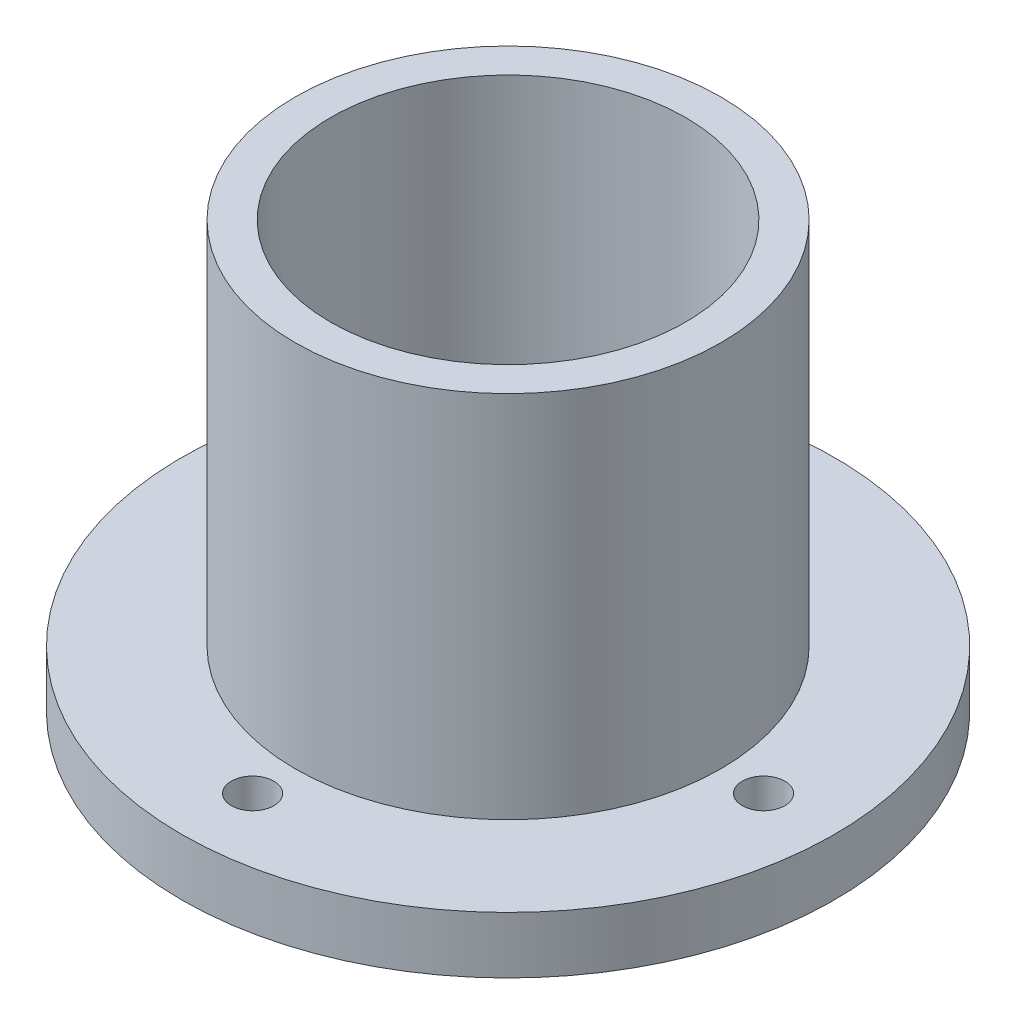
from build123d import *

# Parameters (mm, degrees)
SKETCH_1_R          = 15
SKETCH_1_R_2        = 12.5
EXTRUDE_1_DEPTH     = 30
SKETCH_1_3_R        = 23
SKETCH_1_3_R_2      = 15
EXTRUDE_2_DEPTH     = 4
CUT_EXTRUDE_3_REACH = 46.249
SKETCH_3_R          = 1.5


with BuildPart() as part:
    # 草图1 → 凸台-拉伸1 (new body)
    with BuildSketch(Plane(origin=(0, 0, 0), x_dir=(1, 0, 0), z_dir=(0, 1, 0))):
        Circle(SKETCH_1_R)
        Circle(SKETCH_1_R_2, mode=Mode.SUBTRACT)
    extrude(amount=EXTRUDE_1_DEPTH)

    # 草图1<3> → 凸台-拉伸2 (add)
    with BuildSketch(Plane(origin=(0, 0, 0), x_dir=(1, 0, 0), z_dir=(0, 1, 0))):
        Circle(SKETCH_1_3_R)
        Circle(SKETCH_1_3_R_2, mode=Mode.SUBTRACT)
    extrude(amount=EXTRUDE_2_DEPTH)

    # 草图3 → 切除-拉伸3 (cut, up to next)
    with BuildSketch(Plane.XZ, mode=Mode.PRIVATE) as cut_extrude_3_sk1:
        with Locations((0, 18)):
            Circle(SKETCH_3_R)
    cut_extrude_3_tool1 = extrude(cut_extrude_3_sk1.sketch, amount=-CUT_EXTRUDE_3_REACH, mode=Mode.PRIVATE) & part.part
    # 草图3 → 切除-拉伸3 (cut, up to next)
    with BuildSketch(Plane.XZ, mode=Mode.PRIVATE) as cut_extrude_3_sk2:
        with Locations((18, 0)):
            Circle(SKETCH_3_R)
    cut_extrude_3_tool2 = extrude(cut_extrude_3_sk2.sketch, amount=-CUT_EXTRUDE_3_REACH, mode=Mode.PRIVATE) & part.part
    # 草图3 → 切除-拉伸3 (cut, up to next)
    with BuildSketch(Plane.XZ, mode=Mode.PRIVATE) as cut_extrude_3_sk3:
        with Locations((0, -18)):
            Circle(SKETCH_3_R)
    cut_extrude_3_tool3 = extrude(cut_extrude_3_sk3.sketch, amount=-CUT_EXTRUDE_3_REACH, mode=Mode.PRIVATE) & part.part
    # 草图3 → 切除-拉伸3 (cut, up to next)
    with BuildSketch(Plane.XZ, mode=Mode.PRIVATE) as cut_extrude_3_sk4:
        with Locations((-18, 0)):
            Circle(SKETCH_3_R)
    cut_extrude_3_tool4 = extrude(cut_extrude_3_sk4.sketch, amount=-CUT_EXTRUDE_3_REACH, mode=Mode.PRIVATE) & part.part
    add(cut_extrude_3_tool1.solids().sort_by_distance((0, 0, 18))[0], mode=Mode.SUBTRACT)
    add(cut_extrude_3_tool2.solids().sort_by_distance((18, 0, 0))[0], mode=Mode.SUBTRACT)
    add(cut_extrude_3_tool3.solids().sort_by_distance((0, 0, -18))[0], mode=Mode.SUBTRACT)
    add(cut_extrude_3_tool4.solids().sort_by_distance((-18, 0, 0))[0], mode=Mode.SUBTRACT)


solid = part.part
